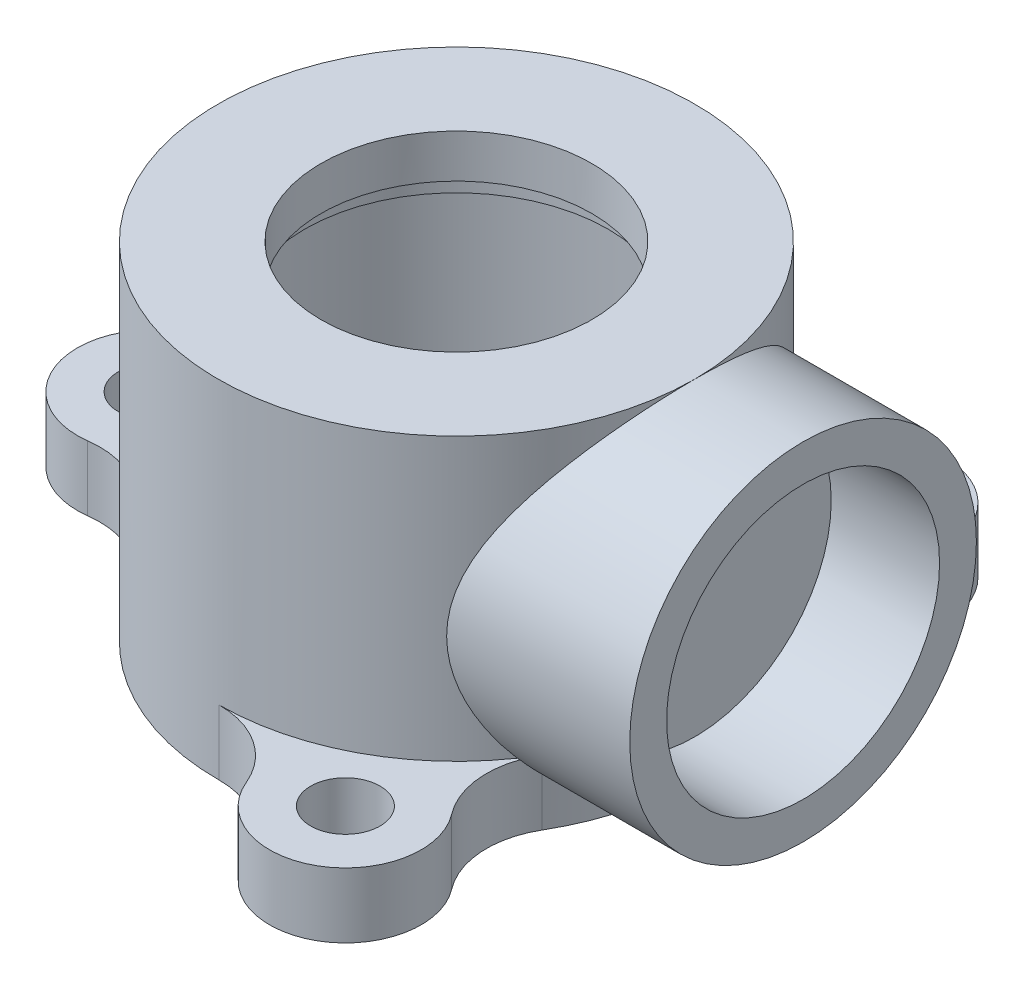
from build123d import *
from build123d.topology import SkipClean

# Parameters (mm, degrees)
SKETCH_1_R          = 11
EXTRUDE_1_DEPTH     = 16
CUT_EXTRUDE_1_REACH = 24.316
SKETCH_2_R          = 6.25
SKETCH_3_R          = 9.25
CUT_EXTRUDE_2_DEPTH = 13
EXTRUDE_2_REACH     = 35.257
SKETCH_4_R          = 8
SKETCH_5_R          = 6.3
CUT_EXTRUDE_3_DEPTH = 5
SKETCH_6_R          = 1.6
EXTRUDE_3_DEPTH     = 3
SKETCH_7_R          = 7
CUT_EXTRUDE_4_DEPTH = 1


with BuildPart() as part:
    # 草图1 → 凸台-拉伸1 (new body)
    with BuildSketch(Plane(origin=(0, 0, 0), x_dir=(1, 0, 0), z_dir=(0, 1, 0))):
        with Locations(Location((0, 0, 0), (0, 0, 270))):
            Circle(SKETCH_1_R)
    extrude(amount=EXTRUDE_1_DEPTH)

    # 草图2 → 切除-拉伸1 (cut, up to next)
    with BuildSketch(Plane(origin=(0, 16, 0), x_dir=(1, 0, 0), z_dir=(0, 1, 0)), mode=Mode.PRIVATE) as cut_extrude_1_sk1:
        with Locations(Location((0, 0, 0), (0, 0, 270))):
            Circle(SKETCH_2_R)
    cut_extrude_1_tool1 = extrude(cut_extrude_1_sk1.sketch, amount=-CUT_EXTRUDE_1_REACH, mode=Mode.PRIVATE) & part.part
    add(cut_extrude_1_tool1.solids().sort_by_distance((0, 16, 0))[0], mode=Mode.SUBTRACT)

    # 草图3 → 切除-拉伸2 (cut)
    with BuildSketch(Plane.XZ):
        with Locations(Location((0, 0, 0), (0, 0, 270))):
            Circle(SKETCH_3_R)
    extrude(amount=-CUT_EXTRUDE_2_DEPTH, mode=Mode.SUBTRACT)

    # 草图4 → 凸台-拉伸2 (add, up to next)
    with BuildSketch(Plane(origin=(16, 0, 0), x_dir=(0, 0, -1), z_dir=(1, 0, 0)), mode=Mode.PRIVATE) as extrude_2_sk1:
        with Locations((0, 8)):
            Circle(SKETCH_4_R)
    extrude_2_tool1 = extrude(extrude_2_sk1.sketch, amount=-EXTRUDE_2_REACH, mode=Mode.PRIVATE) - part.part
    add(extrude_2_tool1.solids().sort_by_distance((16, 8, 0))[0])

    # 草图5 → 切除-拉伸3 (cut)
    with SkipClean():  # the faces are left unmerged after this step: merging them gives an invalid solid
        with BuildSketch(Plane(origin=(16, 0, 0), x_dir=(0, 0, -1), z_dir=(1, 0, 0))):
            with Locations((0, 8)):
                Circle(SKETCH_5_R)
        extrude(amount=-CUT_EXTRUDE_3_DEPTH, mode=Mode.SUBTRACT)

    # 草图6 → 凸台-拉伸3 (add)
    # profile 1 of 3: a face of its own
    with SkipClean():  # the faces are left unmerged after this step: merging them gives an invalid solid
        with BuildSketch(Plane.XZ):
            with BuildLine():
                ThreePointArc((-11, 0), (-10.632091471, 2.821104562), (-9.55297619, 5.453498501))
                ThreePointArc((-9.55297619, 5.453498501), (-11.247511613, 3.854105973), (-13.545833333, 3.470408137))
                ThreePointArc((-13.545833333, 3.470408137), (-17.5, 0), (-13.545833333, -3.470408137))
                ThreePointArc((-13.545833333, -3.470408137), (-11.247511613, -3.854105973), (-9.55297619, -5.453498501))
                ThreePointArc((-9.55297619, -5.453498501), (-10.632091471, -2.821104562), (-11, 0))
            make_face()
            with Locations(Location((-14, 0, 0), (0, 0, 270))):
                Circle(SKETCH_6_R, mode=Mode.SUBTRACT)
        # profile 2 of 3: a face of its own
        with BuildSketch(Plane.XZ):
            with BuildLine():
                ThreePointArc((9.778378275, 9.995831713), (8.75, 15.155444566), (3.767455058, 13.466239851))
                ThreePointArc((3.767455058, 13.466239851), (2.286002125, 11.667683773), (0.053619854, 10.999869313))
                ThreePointArc((0.053619854, 10.999869313), (5.5, 9.526279442), (9.499356337, 5.546370812))
                ThreePointArc((9.499356337, 5.546370812), (8.961509488, 7.8135778), (9.778378275, 9.995831713))
            make_face()
            with Locations(Location((7, 12.124355653, 0), (0, 0, 270))):
                Circle(SKETCH_6_R, mode=Mode.SUBTRACT)
        # profile 3 of 3: a face of its own
        with BuildSketch(Plane.XZ):
            with BuildLine():
                ThreePointArc((3.767455058, -13.466239851), (8.75, -15.155444566), (9.778378275, -9.995831713))
                ThreePointArc((9.778378275, -9.995831713), (8.961509488, -7.8135778), (9.499356337, -5.546370812))
                ThreePointArc((9.499356337, -5.546370812), (5.5, -9.526279442), (0.053619854, -10.999869313))
                ThreePointArc((0.053619854, -10.999869313), (2.286002125, -11.667683773), (3.767455058, -13.466239851))
            make_face()
            with Locations(Location((7, -12.124355653, 0), (0, 0, 270))):
                Circle(SKETCH_6_R, mode=Mode.SUBTRACT)
        extrude(amount=-EXTRUDE_3_DEPTH)

    # 草图7 → 切除-拉伸4 (cut)
    with SkipClean():  # the faces are left unmerged after this step: merging them gives an invalid solid
        with BuildSketch(Plane.XZ.offset(-13)):
            with Locations(Location((0, 0, 0), (0, 0, 270))):
                Circle(SKETCH_7_R)
        extrude(amount=-CUT_EXTRUDE_4_DEPTH, mode=Mode.SUBTRACT)


solid = part.part
